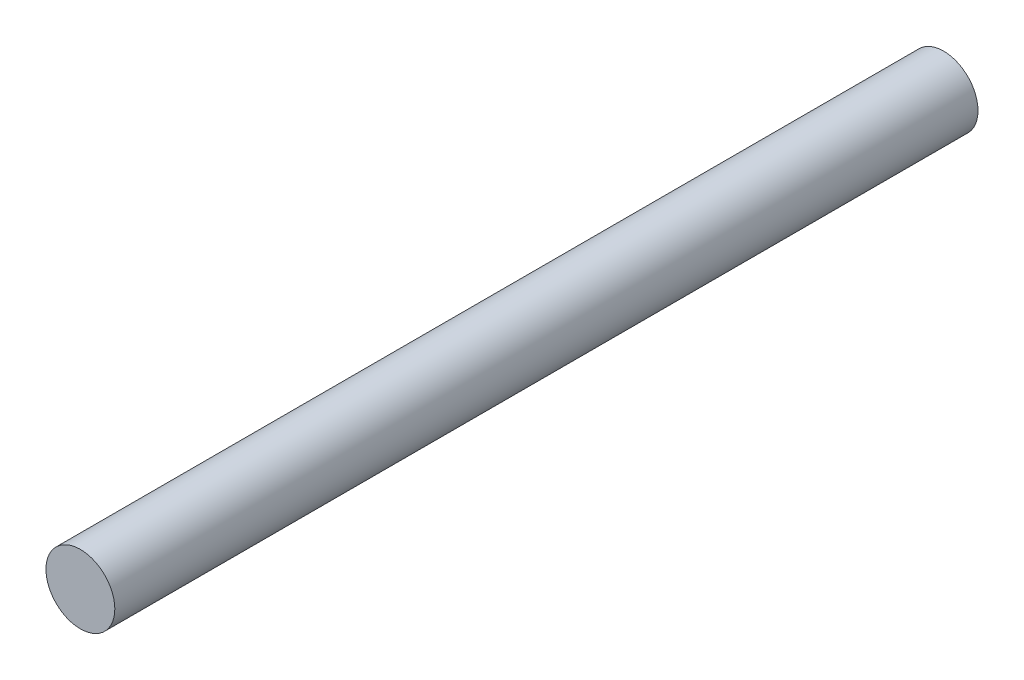
from build123d import *

# Parameters (mm, degrees)
SKETCH1_R           = 0.997499935
BOSS_EXTRUDE1_DEPTH = 25


with BuildPart() as part:
    # Sketch1 → Boss-Extrude1 (new body)
    with BuildSketch(Plane.XY):
        Circle(SKETCH1_R)
    extrude(amount=BOSS_EXTRUDE1_DEPTH)


solid = part.part
